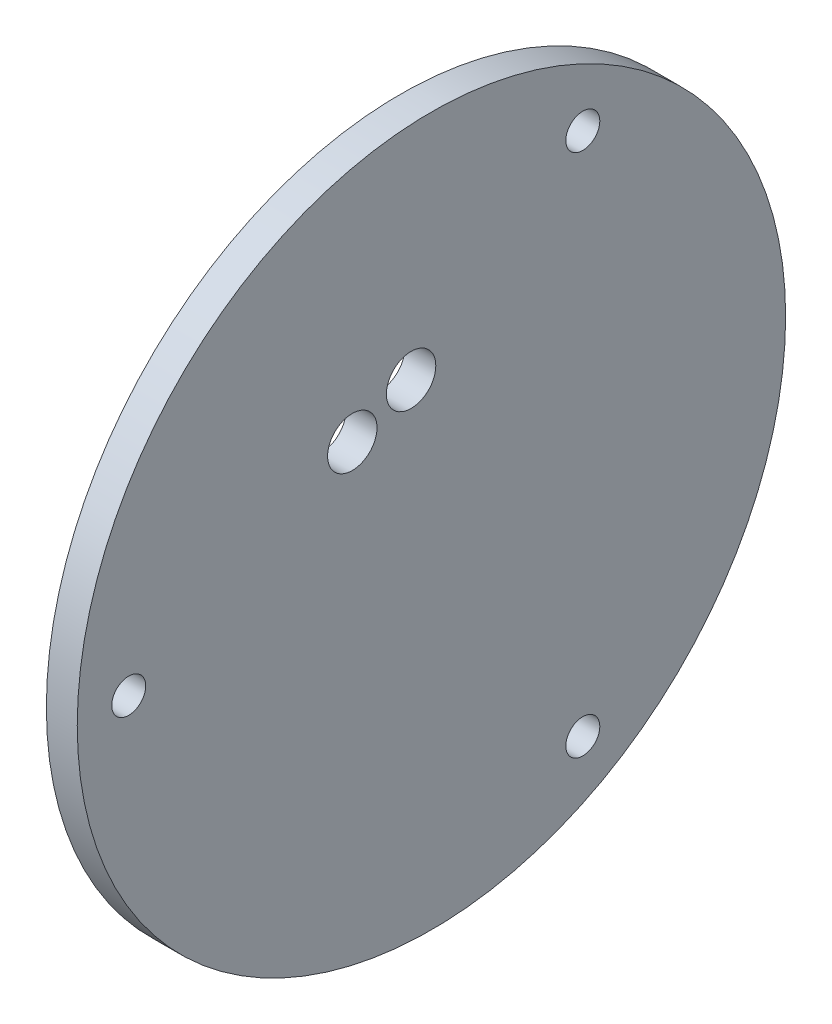
from build123d import *

# Parameters (mm, degrees)
AXIAL_PROFILE_MM_W     = 3
AXIAL_PROFILE_MM_H     = 34.4
AXIAL_HOLES_DEPTH      = 167.945530039
AXIAL_HOLES_DEPTH_BACK = 167.945530039
SKETCH2_R              = 2.4
SKETCH2_R_2            = 1.65


with BuildPart() as part:
    # Axial profile (mm) → Full revolution (revolve)
    with BuildSketch(Plane.XY, mode=Mode.PRIVATE) as full_revolution_sk:
        with Locations((158.2, 17.2)):
            Rectangle(AXIAL_PROFILE_MM_W, AXIAL_PROFILE_MM_H)
    revolve(full_revolution_sk.sketch.rotate(Axis((-110, 0, 0), (1, 0, 0)), 90), axis=Axis((-110, 0, 0), (1, 0, 0)))

    # Sketch2 → Axial holes (cut, two sides: drawn at the far end of the back side and taken through both)
    with BuildSketch(Plane(origin=(0, 0, 0), x_dir=(0, 0, -1), z_dir=(1, 0, 0)).offset(-AXIAL_HOLES_DEPTH_BACK)):
        with Locations((-1.977382665, 12.848733704)):
            Circle(SKETCH2_R)
        with Locations((-7.687206041, 10.483647423)):
            Circle(SKETCH2_R)
        with Locations((-29.4, 0)):
            Circle(SKETCH2_R_2)
        with Locations((14.7, -25.461146871)):
            Circle(SKETCH2_R_2)
        with Locations((14.7, 25.461146871)):
            Circle(SKETCH2_R_2)
    extrude(amount=AXIAL_HOLES_DEPTH + AXIAL_HOLES_DEPTH_BACK, mode=Mode.SUBTRACT)


solid = part.part
